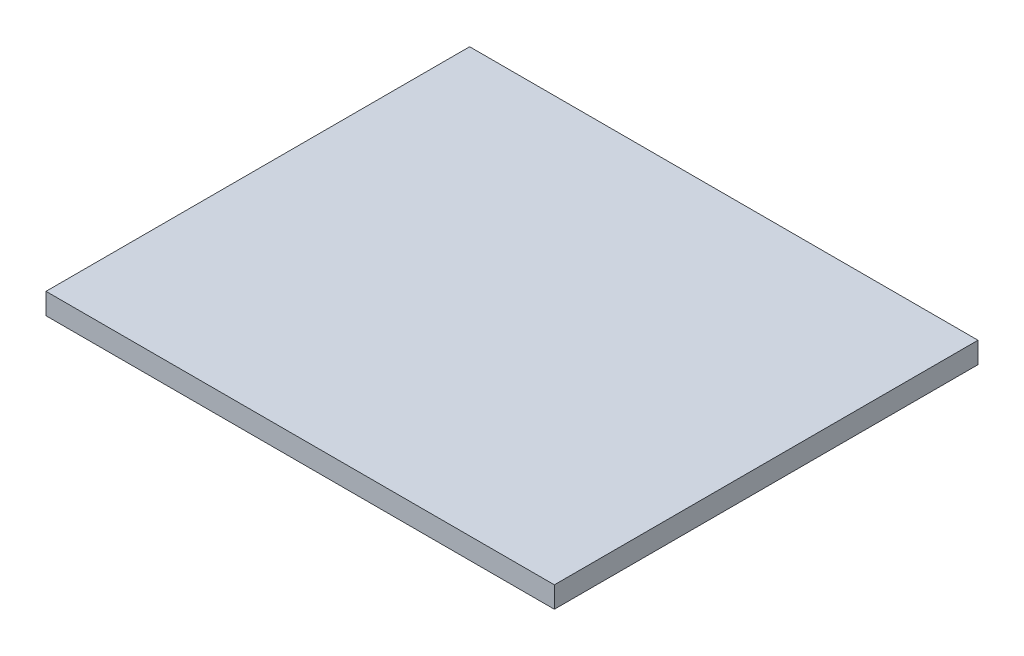
from build123d import *

# Parameters (mm, degrees)
SKETCH1_W           = 304.8
SKETCH1_H           = 254
BOSS_EXTRUDE1_DEPTH = 12.7


with BuildPart() as part:
    # Sketch1 → Boss-Extrude1 (new body)
    with BuildSketch(Plane(origin=(0, 0, 0), x_dir=(1, 0, 0), z_dir=(0, 1, 0))):
        Rectangle(SKETCH1_W, SKETCH1_H)
    extrude(amount=BOSS_EXTRUDE1_DEPTH)


solid = part.part
